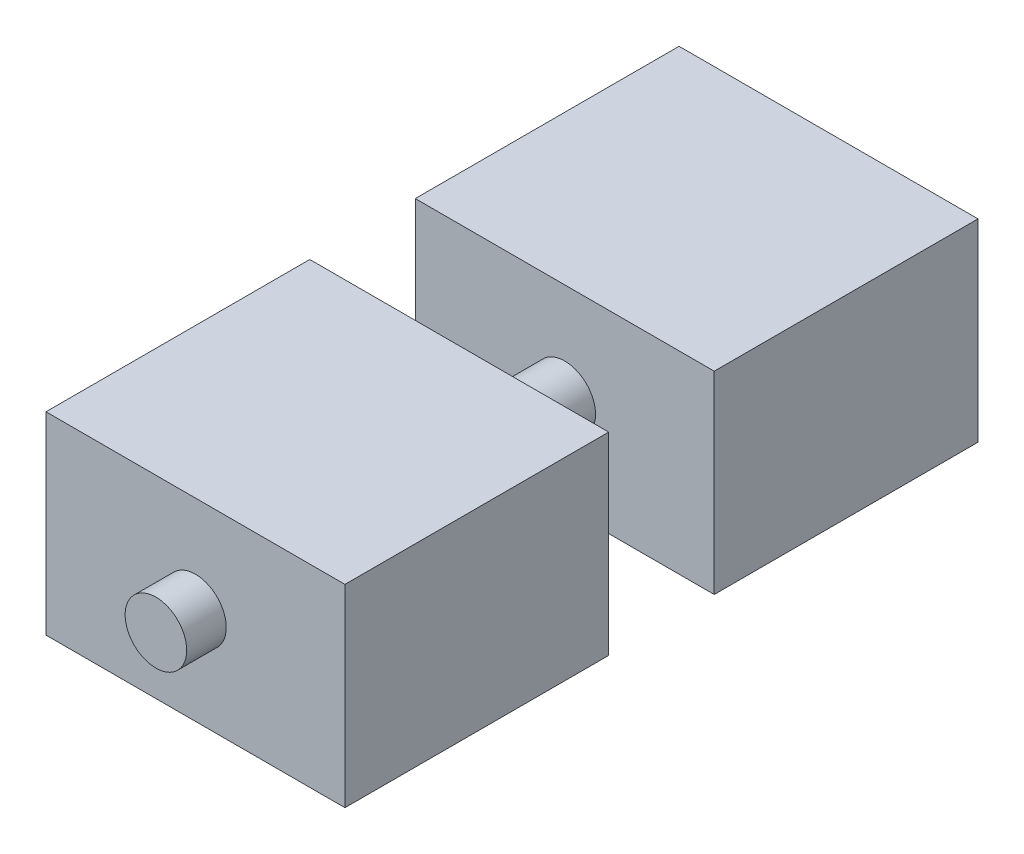
from build123d import *

# Parameters (mm, degrees)
SKETCH_1_W           = 34
SKETCH_1_H           = 30
EXTRUDE_1_DEPTH      = 22
EXTRUDE_1_2_DEPTH    = 22
EXTRUDE_2_DEPTH      = 4.5
EXTRUDE_2_DEPTH_BACK = 75
SKETCH_2_R           = 3.5
SKETCH_3_R           = 2.05
CUT_EXTRUDE_1_DEPTH  = 5


with BuildPart() as part:
    # 草图1 → 凸台-拉伸1 (new body)
    with BuildSketch(Plane(origin=(0, 0, 0), x_dir=(1, 0, 0), z_dir=(0, 1, 0))):
        Rectangle(SKETCH_1_W, SKETCH_1_H)
    extrude(amount=EXTRUDE_1_DEPTH)



with BuildPart() as body_2:
    # 草图1 → Extrude 1 2 (new body)
    with BuildSketch(Plane(origin=(0, 0, 0), x_dir=(1, 0, 0), z_dir=(0, 1, 0))):
        with Locations((0, 42)):
            Rectangle(SKETCH_1_W, SKETCH_1_H)
    extrude(amount=EXTRUDE_1_2_DEPTH)


with BuildPart() as part_1:
    add(part.part)

    add(body_2.part)  # 凸台-拉伸2 merges body 2
    # 草图2 → 凸台-拉伸2 (add, two sides: drawn at the far end of the back side and taken through both)
    with BuildSketch(Plane.XY.offset(15).offset(-EXTRUDE_2_DEPTH_BACK)):
        with Locations((0, 11)):
            Circle(SKETCH_2_R)
    extrude(amount=EXTRUDE_2_DEPTH + EXTRUDE_2_DEPTH_BACK)

    # 草图3 → 切除-拉伸1 (cut)
    with BuildSketch(Plane(origin=(0, 0, 0), x_dir=(-1, 0, 0), z_dir=(0, -1, 0))):
        with Locations(Location((-11.75, 33.25, 0), (0, 0, 90))):
            Circle(SKETCH_3_R)
        with Locations(Location((11.75, 33.25, 0), (0, 0, 90))):
            Circle(SKETCH_3_R)
        with Locations(Location((11.75, 50.75, 0), (0, 0, 90))):
            Circle(SKETCH_3_R)
        with Locations(Location((-11.75, 50.75, 0), (0, 0, 90))):
            Circle(SKETCH_3_R)
        with Locations(Location((-12, -9, 0), (0, 0, 90))):
            Circle(SKETCH_3_R)
        with Locations(Location((-12, 9, 0), (0, 0, 90))):
            Circle(SKETCH_3_R)
        with Locations(Location((12, 9, 0), (0, 0, 90))):
            Circle(SKETCH_3_R)
        with Locations(Location((12, -9, 0), (0, 0, 90))):
            Circle(SKETCH_3_R)
    extrude(amount=-CUT_EXTRUDE_1_DEPTH, mode=Mode.SUBTRACT)


solid = part_1.part
